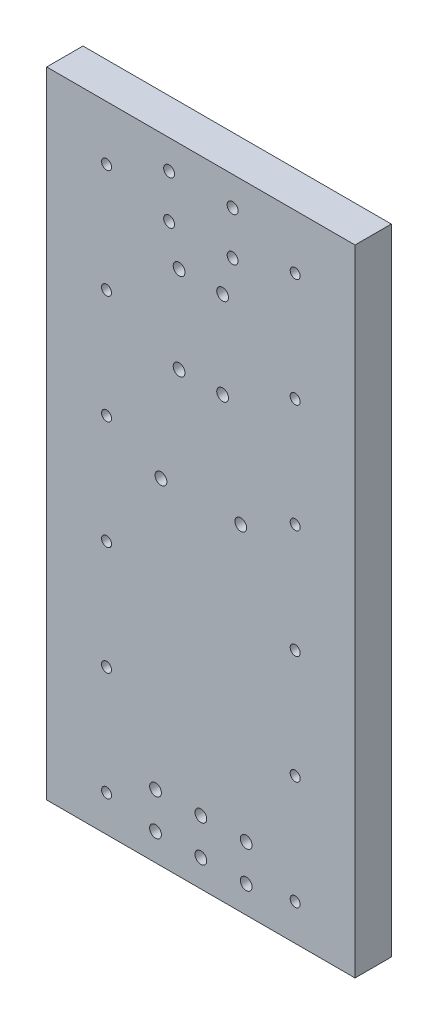
from build123d import *

# Parameters (mm, degrees)
SKIZZE1_W                       = 170
SKIZZE1_H                       = 350
AUFSATZ_LINEAR_AUSTRAGEN1_DEPTH = 20
SKIZZE4_R                       = 3
SCHNITT_LINEAR_AUSTRAGEN3_DEPTH = 30
SKIZZE5_R                       = 2.75
SCHNITT_LINEAR_AUSTRAGEN4_DEPTH = 50
LINEARES_MUSTER1_COUNT          = 6
LINEARES_MUSTER1_PITCH          = 60
SKIZZE6_R                       = 3.25
SCHNITT_LINEAR_AUSTRAGEN5_DEPTH = 40
SKIZZE7_R                       = 3.25
SCHNITT_LINEAR_AUSTRAGEN6_DEPTH = 50


with BuildPart() as part:
    # Skizze1 → Aufsatz-Linear austragen1 (new body)
    with BuildSketch(Plane.XY):
        with Locations((0, 175)):
            Rectangle(SKIZZE1_W, SKIZZE1_H)
    extrude(amount=AUFSATZ_LINEAR_AUSTRAGEN1_DEPTH)

    # Skizze4 → Schnitt-Linear austragen3 (cut)
    with BuildSketch(Plane(origin=(0, 0, 0), x_dir=(-1, 0, 0), z_dir=(0, 0, -1))):
        with Locations((17.5, 334)):
            Circle(SKIZZE4_R)
        with Locations((17.5, 310)):
            Circle(SKIZZE4_R)
        with Locations((-17.5, 310)):
            Circle(SKIZZE4_R)
        with Locations((-17.5, 334)):
            Circle(SKIZZE4_R)
    extrude(amount=-SCHNITT_LINEAR_AUSTRAGEN3_DEPTH, mode=Mode.SUBTRACT)

    # Skizze5 → Schnitt-Linear austragen4 (cut)
    with BuildSketch(Plane.XY.offset(20)):
        with Locations((52, 20)):
            Circle(SKIZZE5_R)
        with Locations(Location((-52, 20, 0), (0, 0, 180))):
            Circle(SKIZZE5_R)
    schnitt_linear_austragen4 = extrude(amount=-SCHNITT_LINEAR_AUSTRAGEN4_DEPTH, mode=Mode.SUBTRACT)

    # Lineares Muster1: Schnitt-Linear austragen4 ×6
    with Locations(*[(0, i * LINEARES_MUSTER1_PITCH, 0) for i in range(1, LINEARES_MUSTER1_COUNT)]):
        add(schnitt_linear_austragen4, mode=Mode.SUBTRACT)

    # Skizze6 → Schnitt-Linear austragen5 (cut)
    with BuildSketch(Plane.XY.offset(20)):
        with Locations((0, 15)):
            Circle(SKIZZE6_R)
        with Locations((25, 15)):
            Circle(SKIZZE6_R)
        with Locations(Location((-25, 15, 0), (0, 0, 180))):
            Circle(SKIZZE6_R)
        with Locations(Location((25, 35, 0), (0, 0, 180))):
            Circle(SKIZZE6_R)
        with Locations(Location((0, 35, 0), (0, 0, 180))):
            Circle(SKIZZE6_R)
        with Locations((-25, 35)):
            Circle(SKIZZE6_R)
    extrude(amount=-SCHNITT_LINEAR_AUSTRAGEN5_DEPTH, mode=Mode.SUBTRACT)

    # Skizze7 → Schnitt-Linear austragen6 (cut)
    with BuildSketch(Plane.XY.offset(20)):
        with Locations((12, 290)):
            Circle(SKIZZE7_R)
        with Locations(Location((-12, 290, 0), (0, 0, 180))):
            Circle(SKIZZE7_R)
        with Locations((12, 242)):
            Circle(SKIZZE7_R)
        with Locations(Location((-12, 242, 0), (0, 0, 180))):
            Circle(SKIZZE7_R)
        with Locations((22, 185)):
            Circle(SKIZZE7_R)
        with Locations(Location((-22, 185, 0), (0, 0, 180))):
            Circle(SKIZZE7_R)
    extrude(amount=-SCHNITT_LINEAR_AUSTRAGEN6_DEPTH, mode=Mode.SUBTRACT)


solid = part.part
